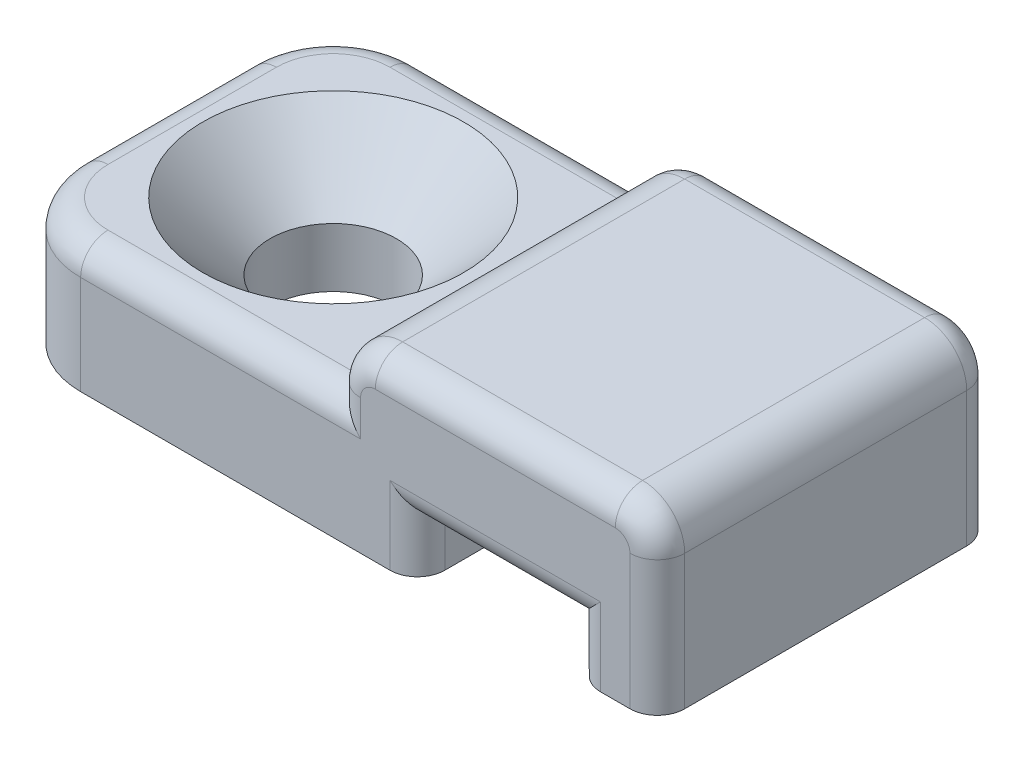
from build123d import *

# Parameters (mm, degrees)
RESSALTO_EXTRUS_O1_DEPTH = 8
ESBO_O2_R                = 1.5
CORTE_EXTRUS_O1_DEPTH    = 6
CHANFRO2_SIZE            = 1.6
FILETE3_R                = 2
FILETE5_R                = 1
FILETE6_R                = 0.65


with BuildPart() as part:
    # Esboço1 → Ressalto-extrusão1 (new body)
    with BuildSketch(Plane.XY):
        Polygon((-11.5, -1.2), (-11.5, 1.8), (-3.5, 1.8), (-3.5, 3), (4.2, 3), (4.2, -1.2), (2.2, -1.2), (2.2, 0), (-1.5, 0), (-1.5, -1.2), align=None)
    extrude(amount=RESSALTO_EXTRUS_O1_DEPTH)

    # Esboço2 → Corte-extrusão1 (cut)
    with BuildSketch(Plane(origin=(0, 1.8, 0), x_dir=(1, 0, 0), z_dir=(0, 1, 0))):
        with Locations(Location((-7.5, -4, 0), (0, 0, 180))):
            Circle(ESBO_O2_R)
    extrude(amount=-CORTE_EXTRUS_O1_DEPTH, mode=Mode.SUBTRACT)

    # Chanfro2
    chanfro2_edges = [part.edges().sort_by_distance(p)[0] for p in [
        (-6, 1.8, 4),
    ]]
    chamfer(chanfro2_edges, length=CHANFRO2_SIZE)

    # Filete3
    filete3_edges = [part.edges().sort_by_distance(p)[0] for p in [
        (-11.5, 0.3, 0),
        (-11.5, 0.3, 8),
    ]]
    fillet(filete3_edges, radius=FILETE3_R)

    # Filete5
    filete5_edges = [part.edges().sort_by_distance(p)[0] for p in [
        (-3.5, 3, 4),
        (4.2, 3, 4),
    ]]
    fillet(filete5_edges, radius=FILETE5_R)

    # Filete6
    filete6_edges = [part.edges().sort_by_distance(p)[0] for p in [
        (-1.5, -0.6, 0),
        (-6.5, 1.8, 0),
        (4.2, 0.4, 0),
        (2.2, -0.6, 0),
        (0.35, 0, 0),
        (4.2, 0.4, 8),
        (-6.5, 1.8, 8),
        (-1.5, -0.6, 8),
        (-11.5, 1.8, 4),
        (-10.914213562, 1.8, 0.585786438),
        (-10.914213562, 1.8, 7.414213562),
        (0.35, 0, 8),
        (-3.5, 1.9, 0),
        (-3.5, 1.9, 8),
        (0.35, 3, 0),
        (3.907106781, 2.707106781, 0),
        (-3.207106781, 2.707106781, 0),
        (0.35, 3, 8),
        (3.907106781, 2.707106781, 8),
        (-3.207106781, 2.707106781, 8),
        (2.2, -0.6, 8),
    ]]
    fillet(filete6_edges, radius=FILETE6_R)


solid = part.part
